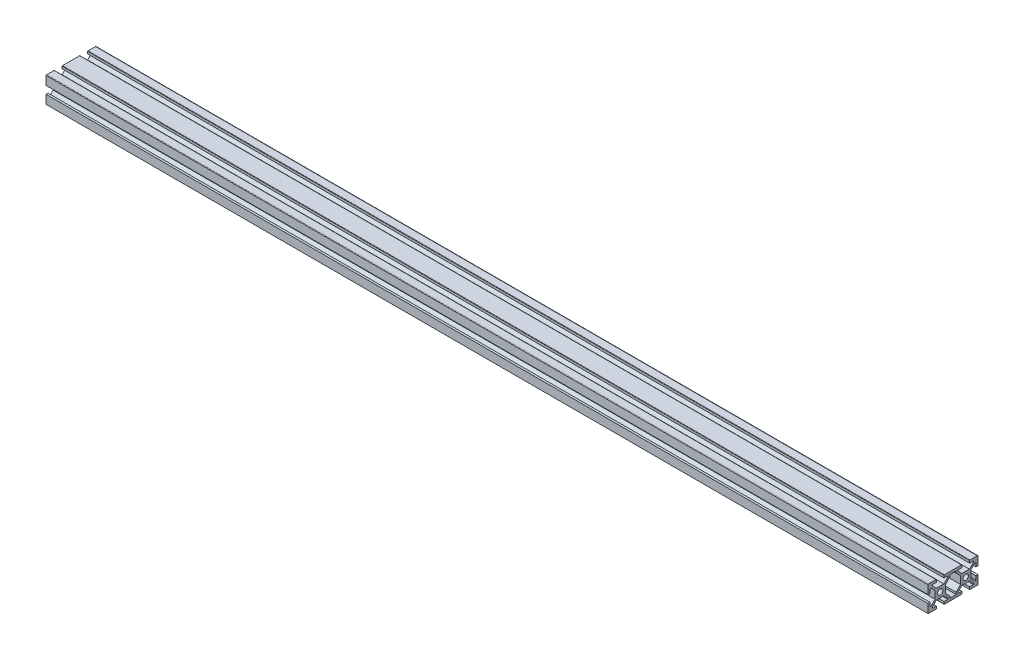
from build123d import *

# Parameters (mm, degrees)
SKETCH_1_R              = 2.1
F_20XS5_20X40S5_1_DEPTH = 690


with BuildPart() as part:
    # 草图1 → 20xs5 20X40S5(1) (new body)
    with BuildSketch(Plane.YZ):
        with BuildLine():
            Line((-10, 19), (-10, 13.3))
            ThreePointArc((-10, 13.3), (-9.912132034, 13.087867966), (-9.7, 13))
            Line((-9.7, 13), (-8, 13))
            Line((-8, 13), (-8, 16))
            Line((-8, 16), (-7.060660172, 16))
            Line((-7.060660172, 16), (-4, 12.939339828))
            Line((-4, 12.939339828), (-4, 7.060660172))
            Line((-4, 7.060660172), (-7.060660172, 4))
            Line((-7.060660172, 4), (-8, 4))
            Line((-8, 4), (-8, 7))
            Line((-8, 7), (-9.7, 7))
            ThreePointArc((-9.7, 7), (-9.912132034, 6.912132034), (-10, 6.7))
            Line((-10, 6.7), (-10, -6.7))
            ThreePointArc((-10, -6.7), (-9.912132034, -6.912132034), (-9.7, -7))
            Line((-9.7, -7), (-8, -7))
            Line((-8, -7), (-8, -4))
            Line((-8, -4), (-7.060660172, -4))
            Line((-7.060660172, -4), (-4, -7.060660172))
            Line((-4, -7.060660172), (-4, -12.939339828))
            Line((-4, -12.939339828), (-7.060660172, -16))
            Line((-7.060660172, -16), (-8, -16))
            Line((-8, -16), (-8, -13))
            Line((-8, -13), (-9.7, -13))
            ThreePointArc((-9.7, -13), (-9.912132034, -13.087867966), (-10, -13.3))
            Line((-10, -13.3), (-10, -19))
            ThreePointArc((-10, -19), (-9.948683298, -19.316227766), (-9.8, -19.6))
            Line((-9.8, -19.6), (-3, -19.6))
            Line((-3, -19.6), (-3, -18))
            Line((-3, -18), (-6, -18))
            Line((-6, -18), (-6, -17.060660172))
            Line((-6, -17.060660172), (-2.939339828, -14))
            Line((-2.939339828, -14), (2.939339828, -14))
            Line((2.939339828, -14), (6, -17.060660172))
            Line((6, -17.060660172), (6, -18))
            Line((6, -18), (3, -18))
            Line((3, -18), (3, -19.6))
            Line((3, -19.6), (9.8, -19.6))
            ThreePointArc((9.8, -19.6), (9.948683298, -19.316227766), (10, -19))
            Line((10, -19), (10, -13.3))
            ThreePointArc((10, -13.3), (9.912132034, -13.087867966), (9.7, -13))
            Line((9.7, -13), (8, -13))
            Line((8, -13), (8, -16))
            Line((8, -16), (7.060660172, -16))
            Line((7.060660172, -16), (4, -12.939339828))
            Line((4, -12.939339828), (4, -7.060660172))
            Line((4, -7.060660172), (7.060660172, -4))
            Line((7.060660172, -4), (8, -4))
            Line((8, -4), (8, -7))
            Line((8, -7), (9.7, -7))
            ThreePointArc((9.7, -7), (9.912132034, -6.912132034), (10, -6.7))
            Line((10, -6.7), (10, 6.7))
            ThreePointArc((10, 6.7), (9.912132034, 6.912132034), (9.7, 7))
            Line((9.7, 7), (8, 7))
            Line((8, 7), (8, 4))
            Line((8, 4), (7.060660172, 4))
            Line((7.060660172, 4), (4, 7.060660172))
            Line((4, 7.060660172), (4, 12.939339828))
            Line((4, 12.939339828), (7.060660172, 16))
            Line((7.060660172, 16), (8, 16))
            Line((8, 16), (8, 13))
            Line((8, 13), (9.7, 13))
            ThreePointArc((9.7, 13), (9.912132034, 13.087867966), (10, 13.3))
            Line((10, 13.3), (10, 19))
            ThreePointArc((10, 19), (9.948683298, 19.316227766), (9.8, 19.6))
            Line((9.8, 19.6), (3, 19.6))
            Line((3, 19.6), (3, 18))
            Line((3, 18), (6, 18))
            Line((6, 18), (6, 17.060660172))
            Line((6, 17.060660172), (2.939339828, 14))
            Line((2.939339828, 14), (-2.939339828, 14))
            Line((-2.939339828, 14), (-6, 17.060660172))
            Line((-6, 17.060660172), (-6, 18))
            Line((-6, 18), (-3, 18))
            Line((-3, 18), (-3, 19.6))
            Line((-3, 19.6), (-9.8, 19.6))
            ThreePointArc((-9.8, 19.6), (-9.948683298, 19.316227766), (-10, 19))
        make_face()
        with Locations((0, -10)):
            Circle(SKETCH_1_R, mode=Mode.SUBTRACT)
        with Locations((0, 10)):
            Circle(SKETCH_1_R, mode=Mode.SUBTRACT)
        Polygon((-8, -2.5), (-6.439339828, -2.5), (-2.939339828, -6), (2.939339828, -6), (6.439339828, -2.5), (8, -2.5), (8, 2.5), (6.439339828, 2.5), (2.939339828, 6), (-2.939339828, 6), (-6.439339828, 2.5), (-8, 2.5), align=None, mode=Mode.SUBTRACT)
    extrude(amount=F_20XS5_20X40S5_1_DEPTH)


solid = part.part
